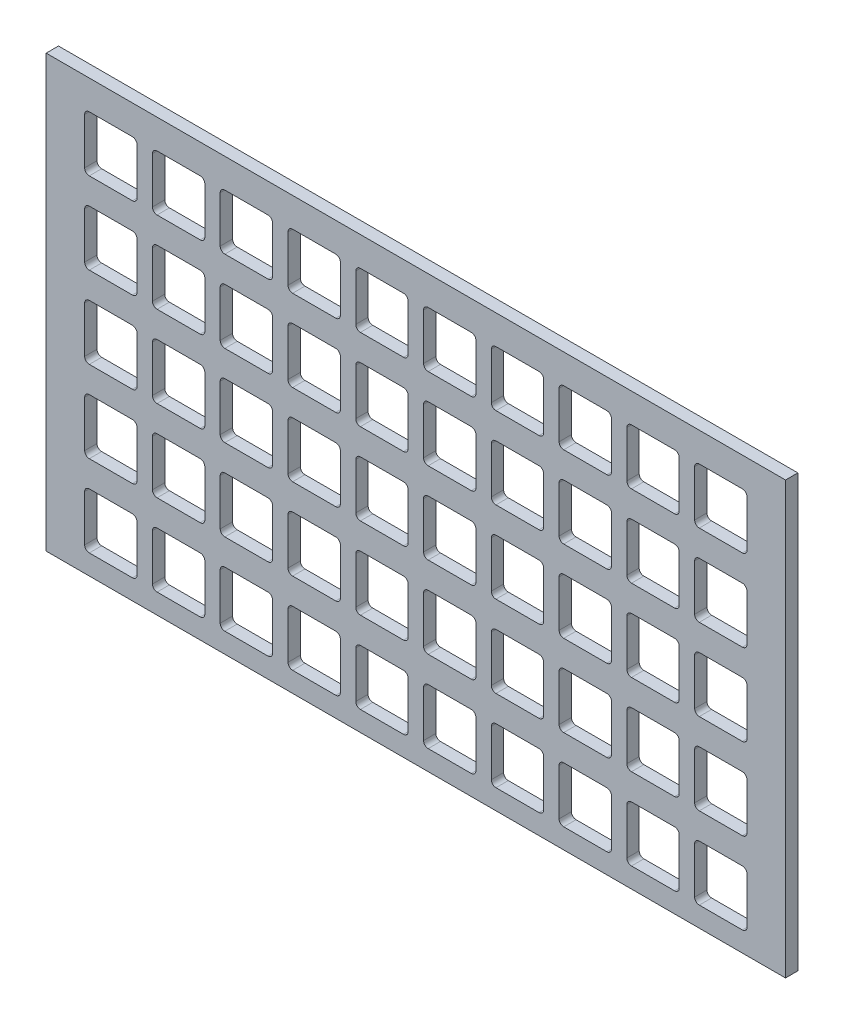
from build123d import *

# Parameters (mm, degrees)
SKETCH1_W               = 240
SKETCH1_H               = 140
BOSS_EXTRUDE1_DEPTH     = 4
HOLE_DEPTH              = 185.434270134
LPATTERN1_COUNT         = 5
LPATTERN1_PITCH         = 22
LPATTERN1_COL_COUNT     = 6
LPATTERN1_COL_PITCH     = 22
LPATTERN2_COUNT         = 5
LPATTERN2_PITCH         = 26.5
LPATTERN2_COPY_1_DEPTH  = 185.434270134
LPATTERN2_COPY_2_DEPTH  = 185.434270134
LPATTERN2_COPY_3_DEPTH  = 185.434270134
LPATTERN2_COPY_4_DEPTH  = 185.434270134
LPATTERN2_COPY_5_DEPTH  = 185.434270134
LPATTERN2_COPY_6_DEPTH  = 185.434270134
LPATTERN2_COPY_7_DEPTH  = 185.434270134
LPATTERN2_COPY_8_DEPTH  = 185.434270134
LPATTERN2_COPY_9_DEPTH  = 185.434270134
LPATTERN2_COPY_10_DEPTH = 185.434270134
LPATTERN2_COPY_11_DEPTH = 185.434270134
LPATTERN2_COPY_12_DEPTH = 185.434270134
LPATTERN2_COPY_13_DEPTH = 185.434270134
LPATTERN2_COPY_14_DEPTH = 185.434270134
LPATTERN2_COPY_15_DEPTH = 185.434270134
LPATTERN2_COPY_16_DEPTH = 185.434270134
LPATTERN2_COPY_17_DEPTH = 185.434270134
LPATTERN2_COPY_18_DEPTH = 185.434270134
LPATTERN2_COPY_19_DEPTH = 185.434270134
LPATTERN2_COPY_20_DEPTH = 185.434270134
LPATTERN2_COPY_21_DEPTH = 185.434270134
LPATTERN2_COPY_22_DEPTH = 185.434270134
LPATTERN2_COPY_23_DEPTH = 185.434270134
LPATTERN2_COPY_24_DEPTH = 185.434270134
LPATTERN2_COPY_25_DEPTH = 185.434270134
LPATTERN2_COPY_26_DEPTH = 185.434270134
LPATTERN2_COPY_27_DEPTH = 185.434270134
LPATTERN2_COPY_28_DEPTH = 185.434270134
LPATTERN2_COPY_29_DEPTH = 185.434270134
LPATTERN2_COPY_30_DEPTH = 185.434270134
LPATTERN2_COPY_31_DEPTH = 185.434270134
LPATTERN2_COPY_32_DEPTH = 185.434270134
LPATTERN2_COPY_33_DEPTH = 185.434270134
LPATTERN2_COPY_34_DEPTH = 185.434270134
LPATTERN2_COPY_35_DEPTH = 185.434270134
LPATTERN2_COPY_36_DEPTH = 185.434270134


with BuildPart() as part:
    # Sketch1 → Boss-Extrude1 (new body)
    with BuildSketch(Plane.XY):
        with Locations((0, 70)):
            Rectangle(SKETCH1_W, SKETCH1_H)
    extrude(amount=BOSS_EXTRUDE1_DEPTH)

    # Sketch2 → Hole (cut, through all)
    with BuildSketch(Plane.XY.offset(4)):
        with BuildLine():
            Line((-18, 6.5), (-4, 6.5))
            ThreePointArc((-4, 6.5), (-2.939339828, 6.939339828), (-2.5, 8))
            Line((-2.5, 8), (-2.5, 23))
            ThreePointArc((-2.5, 23), (-2.939339828, 24.060660172), (-4, 24.5))
            Line((-4, 24.5), (-18, 24.5))
            ThreePointArc((-18, 24.5), (-19.060660172, 24.060660172), (-19.5, 23))
            Line((-19.5, 23), (-19.5, 8))
            ThreePointArc((-19.5, 8), (-19.060660172, 6.939339828), (-18, 6.5))
        make_face()
    hole = extrude(amount=-HOLE_DEPTH, mode=Mode.SUBTRACT)

    # LPattern1: Hole ×5
    with Locations(*[(-i * LPATTERN1_PITCH, 0, 0) for i in range(1, LPATTERN1_COUNT)]):
        add(hole, mode=Mode.SUBTRACT)

    # LPattern1 col: Hole ×6
    with Locations(*[(i * LPATTERN1_COL_PITCH, 0, 0) for i in range(1, LPATTERN1_COL_COUNT)]):
        add(hole, mode=Mode.SUBTRACT)

    # LPattern2: Hole ×5
    with Locations(*[(0, i * LPATTERN2_PITCH, 0) for i in range(1, LPATTERN2_COUNT)]):
        add(hole, mode=Mode.SUBTRACT)

    # LPattern2 copy 1 sketch → LPattern2 copy 1 (cut, through all)
    with BuildSketch(Plane(origin=(-22, 26.5, 4), x_dir=(1, 0, 0), z_dir=(0, 0, 1))):
        with BuildLine():
            Line((-18, 6.5), (-4, 6.5))
            ThreePointArc((-4, 6.5), (-2.939339828, 6.939339828), (-2.5, 8))
            Line((-2.5, 8), (-2.5, 23))
            ThreePointArc((-2.5, 23), (-2.939339828, 24.060660172), (-4, 24.5))
            Line((-4, 24.5), (-18, 24.5))
            ThreePointArc((-18, 24.5), (-19.060660172, 24.060660172), (-19.5, 23))
            Line((-19.5, 23), (-19.5, 8))
            ThreePointArc((-19.5, 8), (-19.060660172, 6.939339828), (-18, 6.5))
        make_face()
    extrude(amount=-LPATTERN2_COPY_1_DEPTH, mode=Mode.SUBTRACT)

    # LPattern2 copy 2 sketch → LPattern2 copy 2 (cut, through all)
    with BuildSketch(Plane(origin=(-22, 53, 4), x_dir=(1, 0, 0), z_dir=(0, 0, 1))):
        with BuildLine():
            Line((-18, 6.5), (-4, 6.5))
            ThreePointArc((-4, 6.5), (-2.939339828, 6.939339828), (-2.5, 8))
            Line((-2.5, 8), (-2.5, 23))
            ThreePointArc((-2.5, 23), (-2.939339828, 24.060660172), (-4, 24.5))
            Line((-4, 24.5), (-18, 24.5))
            ThreePointArc((-18, 24.5), (-19.060660172, 24.060660172), (-19.5, 23))
            Line((-19.5, 23), (-19.5, 8))
            ThreePointArc((-19.5, 8), (-19.060660172, 6.939339828), (-18, 6.5))
        make_face()
    extrude(amount=-LPATTERN2_COPY_2_DEPTH, mode=Mode.SUBTRACT)

    # LPattern2 copy 3 sketch → LPattern2 copy 3 (cut, through all)
    with BuildSketch(Plane(origin=(-22, 79.5, 4), x_dir=(1, 0, 0), z_dir=(0, 0, 1))):
        with BuildLine():
            Line((-18, 6.5), (-4, 6.5))
            ThreePointArc((-4, 6.5), (-2.939339828, 6.939339828), (-2.5, 8))
            Line((-2.5, 8), (-2.5, 23))
            ThreePointArc((-2.5, 23), (-2.939339828, 24.060660172), (-4, 24.5))
            Line((-4, 24.5), (-18, 24.5))
            ThreePointArc((-18, 24.5), (-19.060660172, 24.060660172), (-19.5, 23))
            Line((-19.5, 23), (-19.5, 8))
            ThreePointArc((-19.5, 8), (-19.060660172, 6.939339828), (-18, 6.5))
        make_face()
    extrude(amount=-LPATTERN2_COPY_3_DEPTH, mode=Mode.SUBTRACT)

    # LPattern2 copy 4 sketch → LPattern2 copy 4 (cut, through all)
    with BuildSketch(Plane(origin=(-22, 106, 4), x_dir=(1, 0, 0), z_dir=(0, 0, 1))):
        with BuildLine():
            Line((-18, 6.5), (-4, 6.5))
            ThreePointArc((-4, 6.5), (-2.939339828, 6.939339828), (-2.5, 8))
            Line((-2.5, 8), (-2.5, 23))
            ThreePointArc((-2.5, 23), (-2.939339828, 24.060660172), (-4, 24.5))
            Line((-4, 24.5), (-18, 24.5))
            ThreePointArc((-18, 24.5), (-19.060660172, 24.060660172), (-19.5, 23))
            Line((-19.5, 23), (-19.5, 8))
            ThreePointArc((-19.5, 8), (-19.060660172, 6.939339828), (-18, 6.5))
        make_face()
    extrude(amount=-LPATTERN2_COPY_4_DEPTH, mode=Mode.SUBTRACT)

    # LPattern2 copy 5 sketch → LPattern2 copy 5 (cut, through all)
    with BuildSketch(Plane(origin=(-44, 26.5, 4), x_dir=(1, 0, 0), z_dir=(0, 0, 1))):
        with BuildLine():
            Line((-18, 6.5), (-4, 6.5))
            ThreePointArc((-4, 6.5), (-2.939339828, 6.939339828), (-2.5, 8))
            Line((-2.5, 8), (-2.5, 23))
            ThreePointArc((-2.5, 23), (-2.939339828, 24.060660172), (-4, 24.5))
            Line((-4, 24.5), (-18, 24.5))
            ThreePointArc((-18, 24.5), (-19.060660172, 24.060660172), (-19.5, 23))
            Line((-19.5, 23), (-19.5, 8))
            ThreePointArc((-19.5, 8), (-19.060660172, 6.939339828), (-18, 6.5))
        make_face()
    extrude(amount=-LPATTERN2_COPY_5_DEPTH, mode=Mode.SUBTRACT)

    # LPattern2 copy 6 sketch → LPattern2 copy 6 (cut, through all)
    with BuildSketch(Plane(origin=(-44, 53, 4), x_dir=(1, 0, 0), z_dir=(0, 0, 1))):
        with BuildLine():
            Line((-18, 6.5), (-4, 6.5))
            ThreePointArc((-4, 6.5), (-2.939339828, 6.939339828), (-2.5, 8))
            Line((-2.5, 8), (-2.5, 23))
            ThreePointArc((-2.5, 23), (-2.939339828, 24.060660172), (-4, 24.5))
            Line((-4, 24.5), (-18, 24.5))
            ThreePointArc((-18, 24.5), (-19.060660172, 24.060660172), (-19.5, 23))
            Line((-19.5, 23), (-19.5, 8))
            ThreePointArc((-19.5, 8), (-19.060660172, 6.939339828), (-18, 6.5))
        make_face()
    extrude(amount=-LPATTERN2_COPY_6_DEPTH, mode=Mode.SUBTRACT)

    # LPattern2 copy 7 sketch → LPattern2 copy 7 (cut, through all)
    with BuildSketch(Plane(origin=(-44, 79.5, 4), x_dir=(1, 0, 0), z_dir=(0, 0, 1))):
        with BuildLine():
            Line((-18, 6.5), (-4, 6.5))
            ThreePointArc((-4, 6.5), (-2.939339828, 6.939339828), (-2.5, 8))
            Line((-2.5, 8), (-2.5, 23))
            ThreePointArc((-2.5, 23), (-2.939339828, 24.060660172), (-4, 24.5))
            Line((-4, 24.5), (-18, 24.5))
            ThreePointArc((-18, 24.5), (-19.060660172, 24.060660172), (-19.5, 23))
            Line((-19.5, 23), (-19.5, 8))
            ThreePointArc((-19.5, 8), (-19.060660172, 6.939339828), (-18, 6.5))
        make_face()
    extrude(amount=-LPATTERN2_COPY_7_DEPTH, mode=Mode.SUBTRACT)

    # LPattern2 copy 8 sketch → LPattern2 copy 8 (cut, through all)
    with BuildSketch(Plane(origin=(-44, 106, 4), x_dir=(1, 0, 0), z_dir=(0, 0, 1))):
        with BuildLine():
            Line((-18, 6.5), (-4, 6.5))
            ThreePointArc((-4, 6.5), (-2.939339828, 6.939339828), (-2.5, 8))
            Line((-2.5, 8), (-2.5, 23))
            ThreePointArc((-2.5, 23), (-2.939339828, 24.060660172), (-4, 24.5))
            Line((-4, 24.5), (-18, 24.5))
            ThreePointArc((-18, 24.5), (-19.060660172, 24.060660172), (-19.5, 23))
            Line((-19.5, 23), (-19.5, 8))
            ThreePointArc((-19.5, 8), (-19.060660172, 6.939339828), (-18, 6.5))
        make_face()
    extrude(amount=-LPATTERN2_COPY_8_DEPTH, mode=Mode.SUBTRACT)

    # LPattern2 copy 9 sketch → LPattern2 copy 9 (cut, through all)
    with BuildSketch(Plane(origin=(-66, 26.5, 4), x_dir=(1, 0, 0), z_dir=(0, 0, 1))):
        with BuildLine():
            Line((-18, 6.5), (-4, 6.5))
            ThreePointArc((-4, 6.5), (-2.939339828, 6.939339828), (-2.5, 8))
            Line((-2.5, 8), (-2.5, 23))
            ThreePointArc((-2.5, 23), (-2.939339828, 24.060660172), (-4, 24.5))
            Line((-4, 24.5), (-18, 24.5))
            ThreePointArc((-18, 24.5), (-19.060660172, 24.060660172), (-19.5, 23))
            Line((-19.5, 23), (-19.5, 8))
            ThreePointArc((-19.5, 8), (-19.060660172, 6.939339828), (-18, 6.5))
        make_face()
    extrude(amount=-LPATTERN2_COPY_9_DEPTH, mode=Mode.SUBTRACT)

    # LPattern2 copy 10 sketch → LPattern2 copy 10 (cut, through all)
    with BuildSketch(Plane(origin=(-66, 53, 4), x_dir=(1, 0, 0), z_dir=(0, 0, 1))):
        with BuildLine():
            Line((-18, 6.5), (-4, 6.5))
            ThreePointArc((-4, 6.5), (-2.939339828, 6.939339828), (-2.5, 8))
            Line((-2.5, 8), (-2.5, 23))
            ThreePointArc((-2.5, 23), (-2.939339828, 24.060660172), (-4, 24.5))
            Line((-4, 24.5), (-18, 24.5))
            ThreePointArc((-18, 24.5), (-19.060660172, 24.060660172), (-19.5, 23))
            Line((-19.5, 23), (-19.5, 8))
            ThreePointArc((-19.5, 8), (-19.060660172, 6.939339828), (-18, 6.5))
        make_face()
    extrude(amount=-LPATTERN2_COPY_10_DEPTH, mode=Mode.SUBTRACT)

    # LPattern2 copy 11 sketch → LPattern2 copy 11 (cut, through all)
    with BuildSketch(Plane(origin=(-66, 79.5, 4), x_dir=(1, 0, 0), z_dir=(0, 0, 1))):
        with BuildLine():
            Line((-18, 6.5), (-4, 6.5))
            ThreePointArc((-4, 6.5), (-2.939339828, 6.939339828), (-2.5, 8))
            Line((-2.5, 8), (-2.5, 23))
            ThreePointArc((-2.5, 23), (-2.939339828, 24.060660172), (-4, 24.5))
            Line((-4, 24.5), (-18, 24.5))
            ThreePointArc((-18, 24.5), (-19.060660172, 24.060660172), (-19.5, 23))
            Line((-19.5, 23), (-19.5, 8))
            ThreePointArc((-19.5, 8), (-19.060660172, 6.939339828), (-18, 6.5))
        make_face()
    extrude(amount=-LPATTERN2_COPY_11_DEPTH, mode=Mode.SUBTRACT)

    # LPattern2 copy 12 sketch → LPattern2 copy 12 (cut, through all)
    with BuildSketch(Plane(origin=(-66, 106, 4), x_dir=(1, 0, 0), z_dir=(0, 0, 1))):
        with BuildLine():
            Line((-18, 6.5), (-4, 6.5))
            ThreePointArc((-4, 6.5), (-2.939339828, 6.939339828), (-2.5, 8))
            Line((-2.5, 8), (-2.5, 23))
            ThreePointArc((-2.5, 23), (-2.939339828, 24.060660172), (-4, 24.5))
            Line((-4, 24.5), (-18, 24.5))
            ThreePointArc((-18, 24.5), (-19.060660172, 24.060660172), (-19.5, 23))
            Line((-19.5, 23), (-19.5, 8))
            ThreePointArc((-19.5, 8), (-19.060660172, 6.939339828), (-18, 6.5))
        make_face()
    extrude(amount=-LPATTERN2_COPY_12_DEPTH, mode=Mode.SUBTRACT)

    # LPattern2 copy 13 sketch → LPattern2 copy 13 (cut, through all)
    with BuildSketch(Plane(origin=(-88, 26.5, 4), x_dir=(1, 0, 0), z_dir=(0, 0, 1))):
        with BuildLine():
            Line((-18, 6.5), (-4, 6.5))
            ThreePointArc((-4, 6.5), (-2.939339828, 6.939339828), (-2.5, 8))
            Line((-2.5, 8), (-2.5, 23))
            ThreePointArc((-2.5, 23), (-2.939339828, 24.060660172), (-4, 24.5))
            Line((-4, 24.5), (-18, 24.5))
            ThreePointArc((-18, 24.5), (-19.060660172, 24.060660172), (-19.5, 23))
            Line((-19.5, 23), (-19.5, 8))
            ThreePointArc((-19.5, 8), (-19.060660172, 6.939339828), (-18, 6.5))
        make_face()
    extrude(amount=-LPATTERN2_COPY_13_DEPTH, mode=Mode.SUBTRACT)

    # LPattern2 copy 14 sketch → LPattern2 copy 14 (cut, through all)
    with BuildSketch(Plane(origin=(-88, 53, 4), x_dir=(1, 0, 0), z_dir=(0, 0, 1))):
        with BuildLine():
            Line((-18, 6.5), (-4, 6.5))
            ThreePointArc((-4, 6.5), (-2.939339828, 6.939339828), (-2.5, 8))
            Line((-2.5, 8), (-2.5, 23))
            ThreePointArc((-2.5, 23), (-2.939339828, 24.060660172), (-4, 24.5))
            Line((-4, 24.5), (-18, 24.5))
            ThreePointArc((-18, 24.5), (-19.060660172, 24.060660172), (-19.5, 23))
            Line((-19.5, 23), (-19.5, 8))
            ThreePointArc((-19.5, 8), (-19.060660172, 6.939339828), (-18, 6.5))
        make_face()
    extrude(amount=-LPATTERN2_COPY_14_DEPTH, mode=Mode.SUBTRACT)

    # LPattern2 copy 15 sketch → LPattern2 copy 15 (cut, through all)
    with BuildSketch(Plane(origin=(-88, 79.5, 4), x_dir=(1, 0, 0), z_dir=(0, 0, 1))):
        with BuildLine():
            Line((-18, 6.5), (-4, 6.5))
            ThreePointArc((-4, 6.5), (-2.939339828, 6.939339828), (-2.5, 8))
            Line((-2.5, 8), (-2.5, 23))
            ThreePointArc((-2.5, 23), (-2.939339828, 24.060660172), (-4, 24.5))
            Line((-4, 24.5), (-18, 24.5))
            ThreePointArc((-18, 24.5), (-19.060660172, 24.060660172), (-19.5, 23))
            Line((-19.5, 23), (-19.5, 8))
            ThreePointArc((-19.5, 8), (-19.060660172, 6.939339828), (-18, 6.5))
        make_face()
    extrude(amount=-LPATTERN2_COPY_15_DEPTH, mode=Mode.SUBTRACT)

    # LPattern2 copy 16 sketch → LPattern2 copy 16 (cut, through all)
    with BuildSketch(Plane(origin=(-88, 106, 4), x_dir=(1, 0, 0), z_dir=(0, 0, 1))):
        with BuildLine():
            Line((-18, 6.5), (-4, 6.5))
            ThreePointArc((-4, 6.5), (-2.939339828, 6.939339828), (-2.5, 8))
            Line((-2.5, 8), (-2.5, 23))
            ThreePointArc((-2.5, 23), (-2.939339828, 24.060660172), (-4, 24.5))
            Line((-4, 24.5), (-18, 24.5))
            ThreePointArc((-18, 24.5), (-19.060660172, 24.060660172), (-19.5, 23))
            Line((-19.5, 23), (-19.5, 8))
            ThreePointArc((-19.5, 8), (-19.060660172, 6.939339828), (-18, 6.5))
        make_face()
    extrude(amount=-LPATTERN2_COPY_16_DEPTH, mode=Mode.SUBTRACT)

    # LPattern2 copy 17 sketch → LPattern2 copy 17 (cut, through all)
    with BuildSketch(Plane(origin=(22, 26.5, 4), x_dir=(1, 0, 0), z_dir=(0, 0, 1))):
        with BuildLine():
            Line((-18, 6.5), (-4, 6.5))
            ThreePointArc((-4, 6.5), (-2.939339828, 6.939339828), (-2.5, 8))
            Line((-2.5, 8), (-2.5, 23))
            ThreePointArc((-2.5, 23), (-2.939339828, 24.060660172), (-4, 24.5))
            Line((-4, 24.5), (-18, 24.5))
            ThreePointArc((-18, 24.5), (-19.060660172, 24.060660172), (-19.5, 23))
            Line((-19.5, 23), (-19.5, 8))
            ThreePointArc((-19.5, 8), (-19.060660172, 6.939339828), (-18, 6.5))
        make_face()
    extrude(amount=-LPATTERN2_COPY_17_DEPTH, mode=Mode.SUBTRACT)

    # LPattern2 copy 18 sketch → LPattern2 copy 18 (cut, through all)
    with BuildSketch(Plane(origin=(22, 53, 4), x_dir=(1, 0, 0), z_dir=(0, 0, 1))):
        with BuildLine():
            Line((-18, 6.5), (-4, 6.5))
            ThreePointArc((-4, 6.5), (-2.939339828, 6.939339828), (-2.5, 8))
            Line((-2.5, 8), (-2.5, 23))
            ThreePointArc((-2.5, 23), (-2.939339828, 24.060660172), (-4, 24.5))
            Line((-4, 24.5), (-18, 24.5))
            ThreePointArc((-18, 24.5), (-19.060660172, 24.060660172), (-19.5, 23))
            Line((-19.5, 23), (-19.5, 8))
            ThreePointArc((-19.5, 8), (-19.060660172, 6.939339828), (-18, 6.5))
        make_face()
    extrude(amount=-LPATTERN2_COPY_18_DEPTH, mode=Mode.SUBTRACT)

    # LPattern2 copy 19 sketch → LPattern2 copy 19 (cut, through all)
    with BuildSketch(Plane(origin=(22, 79.5, 4), x_dir=(1, 0, 0), z_dir=(0, 0, 1))):
        with BuildLine():
            Line((-18, 6.5), (-4, 6.5))
            ThreePointArc((-4, 6.5), (-2.939339828, 6.939339828), (-2.5, 8))
            Line((-2.5, 8), (-2.5, 23))
            ThreePointArc((-2.5, 23), (-2.939339828, 24.060660172), (-4, 24.5))
            Line((-4, 24.5), (-18, 24.5))
            ThreePointArc((-18, 24.5), (-19.060660172, 24.060660172), (-19.5, 23))
            Line((-19.5, 23), (-19.5, 8))
            ThreePointArc((-19.5, 8), (-19.060660172, 6.939339828), (-18, 6.5))
        make_face()
    extrude(amount=-LPATTERN2_COPY_19_DEPTH, mode=Mode.SUBTRACT)

    # LPattern2 copy 20 sketch → LPattern2 copy 20 (cut, through all)
    with BuildSketch(Plane(origin=(22, 106, 4), x_dir=(1, 0, 0), z_dir=(0, 0, 1))):
        with BuildLine():
            Line((-18, 6.5), (-4, 6.5))
            ThreePointArc((-4, 6.5), (-2.939339828, 6.939339828), (-2.5, 8))
            Line((-2.5, 8), (-2.5, 23))
            ThreePointArc((-2.5, 23), (-2.939339828, 24.060660172), (-4, 24.5))
            Line((-4, 24.5), (-18, 24.5))
            ThreePointArc((-18, 24.5), (-19.060660172, 24.060660172), (-19.5, 23))
            Line((-19.5, 23), (-19.5, 8))
            ThreePointArc((-19.5, 8), (-19.060660172, 6.939339828), (-18, 6.5))
        make_face()
    extrude(amount=-LPATTERN2_COPY_20_DEPTH, mode=Mode.SUBTRACT)

    # LPattern2 copy 21 sketch → LPattern2 copy 21 (cut, through all)
    with BuildSketch(Plane(origin=(44, 26.5, 4), x_dir=(1, 0, 0), z_dir=(0, 0, 1))):
        with BuildLine():
            Line((-18, 6.5), (-4, 6.5))
            ThreePointArc((-4, 6.5), (-2.939339828, 6.939339828), (-2.5, 8))
            Line((-2.5, 8), (-2.5, 23))
            ThreePointArc((-2.5, 23), (-2.939339828, 24.060660172), (-4, 24.5))
            Line((-4, 24.5), (-18, 24.5))
            ThreePointArc((-18, 24.5), (-19.060660172, 24.060660172), (-19.5, 23))
            Line((-19.5, 23), (-19.5, 8))
            ThreePointArc((-19.5, 8), (-19.060660172, 6.939339828), (-18, 6.5))
        make_face()
    extrude(amount=-LPATTERN2_COPY_21_DEPTH, mode=Mode.SUBTRACT)

    # LPattern2 copy 22 sketch → LPattern2 copy 22 (cut, through all)
    with BuildSketch(Plane(origin=(44, 53, 4), x_dir=(1, 0, 0), z_dir=(0, 0, 1))):
        with BuildLine():
            Line((-18, 6.5), (-4, 6.5))
            ThreePointArc((-4, 6.5), (-2.939339828, 6.939339828), (-2.5, 8))
            Line((-2.5, 8), (-2.5, 23))
            ThreePointArc((-2.5, 23), (-2.939339828, 24.060660172), (-4, 24.5))
            Line((-4, 24.5), (-18, 24.5))
            ThreePointArc((-18, 24.5), (-19.060660172, 24.060660172), (-19.5, 23))
            Line((-19.5, 23), (-19.5, 8))
            ThreePointArc((-19.5, 8), (-19.060660172, 6.939339828), (-18, 6.5))
        make_face()
    extrude(amount=-LPATTERN2_COPY_22_DEPTH, mode=Mode.SUBTRACT)

    # LPattern2 copy 23 sketch → LPattern2 copy 23 (cut, through all)
    with BuildSketch(Plane(origin=(44, 79.5, 4), x_dir=(1, 0, 0), z_dir=(0, 0, 1))):
        with BuildLine():
            Line((-18, 6.5), (-4, 6.5))
            ThreePointArc((-4, 6.5), (-2.939339828, 6.939339828), (-2.5, 8))
            Line((-2.5, 8), (-2.5, 23))
            ThreePointArc((-2.5, 23), (-2.939339828, 24.060660172), (-4, 24.5))
            Line((-4, 24.5), (-18, 24.5))
            ThreePointArc((-18, 24.5), (-19.060660172, 24.060660172), (-19.5, 23))
            Line((-19.5, 23), (-19.5, 8))
            ThreePointArc((-19.5, 8), (-19.060660172, 6.939339828), (-18, 6.5))
        make_face()
    extrude(amount=-LPATTERN2_COPY_23_DEPTH, mode=Mode.SUBTRACT)

    # LPattern2 copy 24 sketch → LPattern2 copy 24 (cut, through all)
    with BuildSketch(Plane(origin=(44, 106, 4), x_dir=(1, 0, 0), z_dir=(0, 0, 1))):
        with BuildLine():
            Line((-18, 6.5), (-4, 6.5))
            ThreePointArc((-4, 6.5), (-2.939339828, 6.939339828), (-2.5, 8))
            Line((-2.5, 8), (-2.5, 23))
            ThreePointArc((-2.5, 23), (-2.939339828, 24.060660172), (-4, 24.5))
            Line((-4, 24.5), (-18, 24.5))
            ThreePointArc((-18, 24.5), (-19.060660172, 24.060660172), (-19.5, 23))
            Line((-19.5, 23), (-19.5, 8))
            ThreePointArc((-19.5, 8), (-19.060660172, 6.939339828), (-18, 6.5))
        make_face()
    extrude(amount=-LPATTERN2_COPY_24_DEPTH, mode=Mode.SUBTRACT)

    # LPattern2 copy 25 sketch → LPattern2 copy 25 (cut, through all)
    with BuildSketch(Plane(origin=(66, 26.5, 4), x_dir=(1, 0, 0), z_dir=(0, 0, 1))):
        with BuildLine():
            Line((-18, 6.5), (-4, 6.5))
            ThreePointArc((-4, 6.5), (-2.939339828, 6.939339828), (-2.5, 8))
            Line((-2.5, 8), (-2.5, 23))
            ThreePointArc((-2.5, 23), (-2.939339828, 24.060660172), (-4, 24.5))
            Line((-4, 24.5), (-18, 24.5))
            ThreePointArc((-18, 24.5), (-19.060660172, 24.060660172), (-19.5, 23))
            Line((-19.5, 23), (-19.5, 8))
            ThreePointArc((-19.5, 8), (-19.060660172, 6.939339828), (-18, 6.5))
        make_face()
    extrude(amount=-LPATTERN2_COPY_25_DEPTH, mode=Mode.SUBTRACT)

    # LPattern2 copy 26 sketch → LPattern2 copy 26 (cut, through all)
    with BuildSketch(Plane(origin=(66, 53, 4), x_dir=(1, 0, 0), z_dir=(0, 0, 1))):
        with BuildLine():
            Line((-18, 6.5), (-4, 6.5))
            ThreePointArc((-4, 6.5), (-2.939339828, 6.939339828), (-2.5, 8))
            Line((-2.5, 8), (-2.5, 23))
            ThreePointArc((-2.5, 23), (-2.939339828, 24.060660172), (-4, 24.5))
            Line((-4, 24.5), (-18, 24.5))
            ThreePointArc((-18, 24.5), (-19.060660172, 24.060660172), (-19.5, 23))
            Line((-19.5, 23), (-19.5, 8))
            ThreePointArc((-19.5, 8), (-19.060660172, 6.939339828), (-18, 6.5))
        make_face()
    extrude(amount=-LPATTERN2_COPY_26_DEPTH, mode=Mode.SUBTRACT)

    # LPattern2 copy 27 sketch → LPattern2 copy 27 (cut, through all)
    with BuildSketch(Plane(origin=(66, 79.5, 4), x_dir=(1, 0, 0), z_dir=(0, 0, 1))):
        with BuildLine():
            Line((-18, 6.5), (-4, 6.5))
            ThreePointArc((-4, 6.5), (-2.939339828, 6.939339828), (-2.5, 8))
            Line((-2.5, 8), (-2.5, 23))
            ThreePointArc((-2.5, 23), (-2.939339828, 24.060660172), (-4, 24.5))
            Line((-4, 24.5), (-18, 24.5))
            ThreePointArc((-18, 24.5), (-19.060660172, 24.060660172), (-19.5, 23))
            Line((-19.5, 23), (-19.5, 8))
            ThreePointArc((-19.5, 8), (-19.060660172, 6.939339828), (-18, 6.5))
        make_face()
    extrude(amount=-LPATTERN2_COPY_27_DEPTH, mode=Mode.SUBTRACT)

    # LPattern2 copy 28 sketch → LPattern2 copy 28 (cut, through all)
    with BuildSketch(Plane(origin=(66, 106, 4), x_dir=(1, 0, 0), z_dir=(0, 0, 1))):
        with BuildLine():
            Line((-18, 6.5), (-4, 6.5))
            ThreePointArc((-4, 6.5), (-2.939339828, 6.939339828), (-2.5, 8))
            Line((-2.5, 8), (-2.5, 23))
            ThreePointArc((-2.5, 23), (-2.939339828, 24.060660172), (-4, 24.5))
            Line((-4, 24.5), (-18, 24.5))
            ThreePointArc((-18, 24.5), (-19.060660172, 24.060660172), (-19.5, 23))
            Line((-19.5, 23), (-19.5, 8))
            ThreePointArc((-19.5, 8), (-19.060660172, 6.939339828), (-18, 6.5))
        make_face()
    extrude(amount=-LPATTERN2_COPY_28_DEPTH, mode=Mode.SUBTRACT)

    # LPattern2 copy 29 sketch → LPattern2 copy 29 (cut, through all)
    with BuildSketch(Plane(origin=(88, 26.5, 4), x_dir=(1, 0, 0), z_dir=(0, 0, 1))):
        with BuildLine():
            Line((-18, 6.5), (-4, 6.5))
            ThreePointArc((-4, 6.5), (-2.939339828, 6.939339828), (-2.5, 8))
            Line((-2.5, 8), (-2.5, 23))
            ThreePointArc((-2.5, 23), (-2.939339828, 24.060660172), (-4, 24.5))
            Line((-4, 24.5), (-18, 24.5))
            ThreePointArc((-18, 24.5), (-19.060660172, 24.060660172), (-19.5, 23))
            Line((-19.5, 23), (-19.5, 8))
            ThreePointArc((-19.5, 8), (-19.060660172, 6.939339828), (-18, 6.5))
        make_face()
    extrude(amount=-LPATTERN2_COPY_29_DEPTH, mode=Mode.SUBTRACT)

    # LPattern2 copy 30 sketch → LPattern2 copy 30 (cut, through all)
    with BuildSketch(Plane(origin=(88, 53, 4), x_dir=(1, 0, 0), z_dir=(0, 0, 1))):
        with BuildLine():
            Line((-18, 6.5), (-4, 6.5))
            ThreePointArc((-4, 6.5), (-2.939339828, 6.939339828), (-2.5, 8))
            Line((-2.5, 8), (-2.5, 23))
            ThreePointArc((-2.5, 23), (-2.939339828, 24.060660172), (-4, 24.5))
            Line((-4, 24.5), (-18, 24.5))
            ThreePointArc((-18, 24.5), (-19.060660172, 24.060660172), (-19.5, 23))
            Line((-19.5, 23), (-19.5, 8))
            ThreePointArc((-19.5, 8), (-19.060660172, 6.939339828), (-18, 6.5))
        make_face()
    extrude(amount=-LPATTERN2_COPY_30_DEPTH, mode=Mode.SUBTRACT)

    # LPattern2 copy 31 sketch → LPattern2 copy 31 (cut, through all)
    with BuildSketch(Plane(origin=(88, 79.5, 4), x_dir=(1, 0, 0), z_dir=(0, 0, 1))):
        with BuildLine():
            Line((-18, 6.5), (-4, 6.5))
            ThreePointArc((-4, 6.5), (-2.939339828, 6.939339828), (-2.5, 8))
            Line((-2.5, 8), (-2.5, 23))
            ThreePointArc((-2.5, 23), (-2.939339828, 24.060660172), (-4, 24.5))
            Line((-4, 24.5), (-18, 24.5))
            ThreePointArc((-18, 24.5), (-19.060660172, 24.060660172), (-19.5, 23))
            Line((-19.5, 23), (-19.5, 8))
            ThreePointArc((-19.5, 8), (-19.060660172, 6.939339828), (-18, 6.5))
        make_face()
    extrude(amount=-LPATTERN2_COPY_31_DEPTH, mode=Mode.SUBTRACT)

    # LPattern2 copy 32 sketch → LPattern2 copy 32 (cut, through all)
    with BuildSketch(Plane(origin=(88, 106, 4), x_dir=(1, 0, 0), z_dir=(0, 0, 1))):
        with BuildLine():
            Line((-18, 6.5), (-4, 6.5))
            ThreePointArc((-4, 6.5), (-2.939339828, 6.939339828), (-2.5, 8))
            Line((-2.5, 8), (-2.5, 23))
            ThreePointArc((-2.5, 23), (-2.939339828, 24.060660172), (-4, 24.5))
            Line((-4, 24.5), (-18, 24.5))
            ThreePointArc((-18, 24.5), (-19.060660172, 24.060660172), (-19.5, 23))
            Line((-19.5, 23), (-19.5, 8))
            ThreePointArc((-19.5, 8), (-19.060660172, 6.939339828), (-18, 6.5))
        make_face()
    extrude(amount=-LPATTERN2_COPY_32_DEPTH, mode=Mode.SUBTRACT)

    # LPattern2 copy 33 sketch → LPattern2 copy 33 (cut, through all)
    with BuildSketch(Plane(origin=(110, 26.5, 4), x_dir=(1, 0, 0), z_dir=(0, 0, 1))):
        with BuildLine():
            Line((-18, 6.5), (-4, 6.5))
            ThreePointArc((-4, 6.5), (-2.939339828, 6.939339828), (-2.5, 8))
            Line((-2.5, 8), (-2.5, 23))
            ThreePointArc((-2.5, 23), (-2.939339828, 24.060660172), (-4, 24.5))
            Line((-4, 24.5), (-18, 24.5))
            ThreePointArc((-18, 24.5), (-19.060660172, 24.060660172), (-19.5, 23))
            Line((-19.5, 23), (-19.5, 8))
            ThreePointArc((-19.5, 8), (-19.060660172, 6.939339828), (-18, 6.5))
        make_face()
    extrude(amount=-LPATTERN2_COPY_33_DEPTH, mode=Mode.SUBTRACT)

    # LPattern2 copy 34 sketch → LPattern2 copy 34 (cut, through all)
    with BuildSketch(Plane(origin=(110, 53, 4), x_dir=(1, 0, 0), z_dir=(0, 0, 1))):
        with BuildLine():
            Line((-18, 6.5), (-4, 6.5))
            ThreePointArc((-4, 6.5), (-2.939339828, 6.939339828), (-2.5, 8))
            Line((-2.5, 8), (-2.5, 23))
            ThreePointArc((-2.5, 23), (-2.939339828, 24.060660172), (-4, 24.5))
            Line((-4, 24.5), (-18, 24.5))
            ThreePointArc((-18, 24.5), (-19.060660172, 24.060660172), (-19.5, 23))
            Line((-19.5, 23), (-19.5, 8))
            ThreePointArc((-19.5, 8), (-19.060660172, 6.939339828), (-18, 6.5))
        make_face()
    extrude(amount=-LPATTERN2_COPY_34_DEPTH, mode=Mode.SUBTRACT)

    # LPattern2 copy 35 sketch → LPattern2 copy 35 (cut, through all)
    with BuildSketch(Plane(origin=(110, 79.5, 4), x_dir=(1, 0, 0), z_dir=(0, 0, 1))):
        with BuildLine():
            Line((-18, 6.5), (-4, 6.5))
            ThreePointArc((-4, 6.5), (-2.939339828, 6.939339828), (-2.5, 8))
            Line((-2.5, 8), (-2.5, 23))
            ThreePointArc((-2.5, 23), (-2.939339828, 24.060660172), (-4, 24.5))
            Line((-4, 24.5), (-18, 24.5))
            ThreePointArc((-18, 24.5), (-19.060660172, 24.060660172), (-19.5, 23))
            Line((-19.5, 23), (-19.5, 8))
            ThreePointArc((-19.5, 8), (-19.060660172, 6.939339828), (-18, 6.5))
        make_face()
    extrude(amount=-LPATTERN2_COPY_35_DEPTH, mode=Mode.SUBTRACT)

    # LPattern2 copy 36 sketch → LPattern2 copy 36 (cut, through all)
    with BuildSketch(Plane(origin=(110, 106, 4), x_dir=(1, 0, 0), z_dir=(0, 0, 1))):
        with BuildLine():
            Line((-18, 6.5), (-4, 6.5))
            ThreePointArc((-4, 6.5), (-2.939339828, 6.939339828), (-2.5, 8))
            Line((-2.5, 8), (-2.5, 23))
            ThreePointArc((-2.5, 23), (-2.939339828, 24.060660172), (-4, 24.5))
            Line((-4, 24.5), (-18, 24.5))
            ThreePointArc((-18, 24.5), (-19.060660172, 24.060660172), (-19.5, 23))
            Line((-19.5, 23), (-19.5, 8))
            ThreePointArc((-19.5, 8), (-19.060660172, 6.939339828), (-18, 6.5))
        make_face()
    extrude(amount=-LPATTERN2_COPY_36_DEPTH, mode=Mode.SUBTRACT)


solid = part.part
